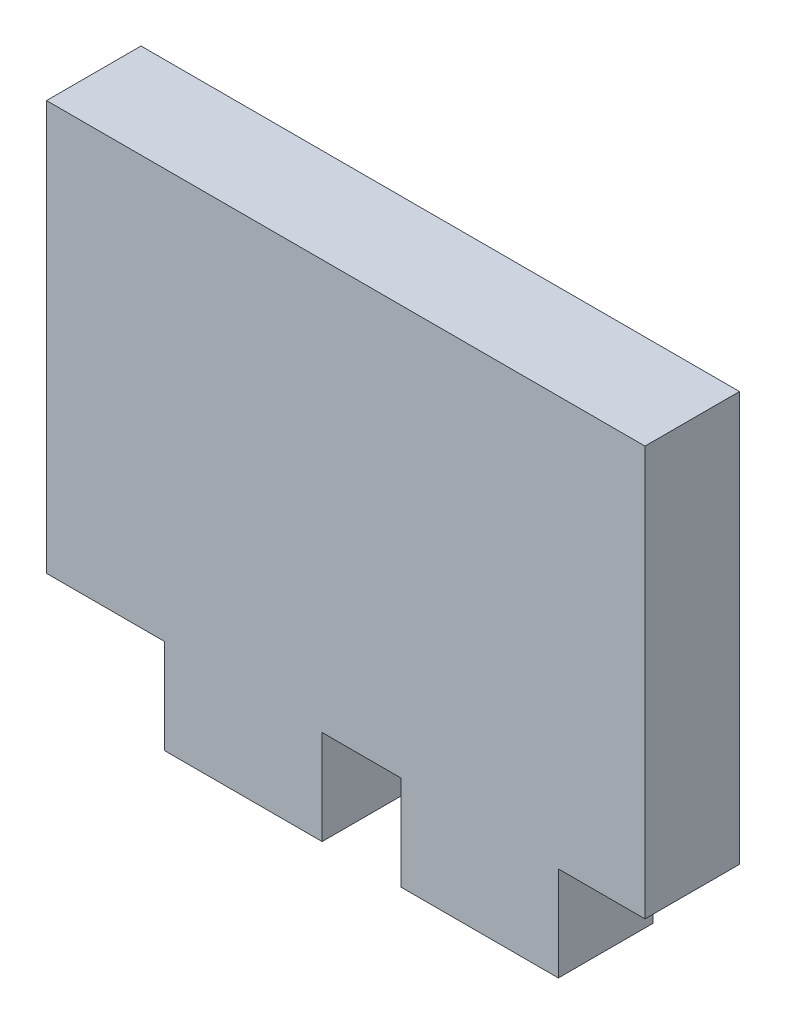
from build123d import *

# Parameters (mm, degrees)
BOSS_EXTRUDE1_DEPTH = 6


with BuildPart() as part:
    # Sketch1 → Boss-Extrude1 (new body)
    with BuildSketch(Plane.XY):
        Polygon((0, 0), (10, 0), (10, 6), (15, 6), (15, 0), (25, 0), (25, 6), (30.5, 6), (30.5, 32), (-7.5, 32), (-7.5, 6), (0, 6), align=None)
    extrude(amount=BOSS_EXTRUDE1_DEPTH)


solid = part.part
